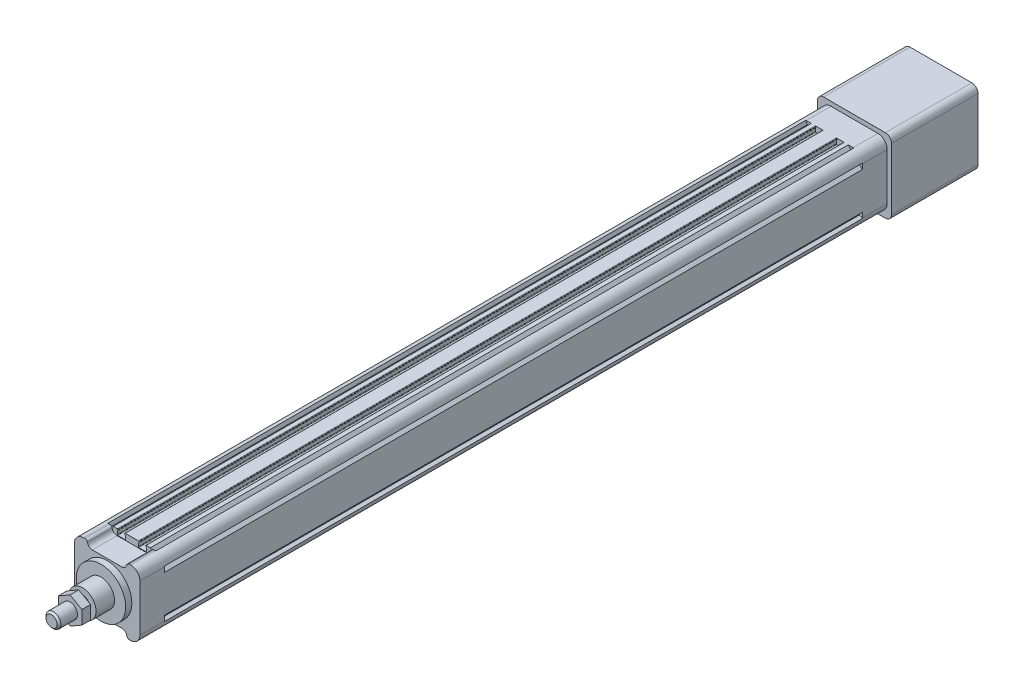
from build123d import *

# Parameters (mm, degrees)
SKETCH_1_R             = 2.1
EXTRUDE_1_DEPTH        = 565
EXTRUDE_2_DEPTH        = 20
SKETCH_7_R             = 20
EXTRUDE_3_DEPTH        = 5
SKETCH_9_R             = 11
EXTRUDE_4_DEPTH        = 15
SKETCH_10_R            = 6
EXTRUDE_5_DEPTH        = 25
EXTRUDE_START          = 20
EXTRUDE_6_DEPTH        = 20
EXTRUDE_7_DEPTH        = 70
SKETCH_14_R            = 19
CUT_EXTRUDE_2_DEPTH    = 70
HOLE_WIZARD_M6_1_D     = 5
HOLE_WIZARD_M6_1_DEPTH = 15
HOLE_WIZARD_M6_1_TIP   = 1.502151548
CHAMFER_1_SIZE         = 1.5
EXTRUDE_START_2        = 3
EXTRUDE_8_DEPTH        = 7


with BuildPart() as part:
    # 草图1 → 凸台-拉伸1 (new body)
    with BuildSketch(Plane.XY):
        with BuildLine():
            Line((-18.2, 24), (-19.443439638, 26.486879276))
            ThreePointArc((-19.443439638, 26.486879276), (-24.303300859, 24.303300859), (-26.486879276, 19.443439638))
            Line((-26.486879276, 19.443439638), (-24, 18.2))
            Line((-24, 18.2), (-24, 17.1))
            Line((-24, 17.1), (-26.5, 15))
            Line((-26.5, 15), (-26.5, -15))
            Line((-26.5, -15), (-24, -17.1))
            Line((-24, -17.1), (-24, -18.2))
            Line((-24, -18.2), (-26.486879276, -19.443439638))
            ThreePointArc((-26.486879276, -19.443439638), (-24.303300859, -24.303300859), (-19.443439638, -26.486879276))
            Line((-19.443439638, -26.486879276), (-18.2, -24))
            Line((-18.2, -24), (-17.1, -24))
            Line((-17.1, -24), (-15, -26.5))
            Line((-15, -26.5), (-11.65, -26.5))
            ThreePointArc((-11.65, -26.5), (-11.367157288, -26.382842712), (-11.25, -26.1))
            Line((-11.25, -26.1), (-11.25, -25.6))
            ThreePointArc((-11.25, -25.6), (-11.367157288, -25.317157288), (-11.65, -25.2))
            Line((-11.65, -25.2), (-11.75, -25.2))
            Line((-11.75, -25.2), (-11.75, -22.4))
            ThreePointArc((-11.75, -22.4), (-11.632842712, -22.117157288), (-11.35, -22))
            Line((-11.35, -22), (-5.65, -22))
            ThreePointArc((-5.65, -22), (-5.367157288, -22.117157288), (-5.25, -22.4))
            Line((-5.25, -22.4), (-5.25, -25.2))
            Line((-5.25, -25.2), (-5.35, -25.2))
            ThreePointArc((-5.35, -25.2), (-5.632842712, -25.317157288), (-5.75, -25.6))
            Line((-5.75, -25.6), (-5.75, -26.1))
            ThreePointArc((-5.75, -26.1), (-5.632842712, -26.382842712), (-5.35, -26.5))
            Line((-5.35, -26.5), (5.35, -26.5))
            ThreePointArc((5.35, -26.5), (5.632842712, -26.382842712), (5.75, -26.1))
            Line((5.75, -26.1), (5.75, -25.6))
            ThreePointArc((5.75, -25.6), (5.632842712, -25.317157288), (5.35, -25.2))
            Line((5.35, -25.2), (5.25, -25.2))
            Line((5.25, -25.2), (5.25, -22.4))
            ThreePointArc((5.25, -22.4), (5.367157288, -22.117157288), (5.65, -22))
            Line((5.65, -22), (11.35, -22))
            ThreePointArc((11.35, -22), (11.632842712, -22.117157288), (11.75, -22.4))
            Line((11.75, -22.4), (11.75, -25.2))
            Line((11.75, -25.2), (11.65, -25.2))
            ThreePointArc((11.65, -25.2), (11.367157288, -25.317157288), (11.25, -25.6))
            Line((11.25, -25.6), (11.25, -26.1))
            ThreePointArc((11.25, -26.1), (11.367157288, -26.382842712), (11.65, -26.5))
            Line((11.65, -26.5), (15, -26.5))
            Line((15, -26.5), (17.1, -24))
            Line((17.1, -24), (18.2, -24))
            Line((18.2, -24), (19.443439638, -26.486879276))
            ThreePointArc((19.443439638, -26.486879276), (24.303300859, -24.303300859), (26.486879276, -19.443439638))
            Line((26.486879276, -19.443439638), (24, -18.2))
            Line((24, -18.2), (24, -17.1))
            Line((24, -17.1), (26.5, -15))
            Line((26.5, -15), (26.5, 15))
            Line((26.5, 15), (24, 17.1))
            Line((24, 17.1), (24, 18.2))
            Line((24, 18.2), (26.486879276, 19.443439638))
            ThreePointArc((26.486879276, 19.443439638), (24.303300859, 24.303300859), (19.443439638, 26.486879276))
            Line((19.443439638, 26.486879276), (18.2, 24))
            Line((18.2, 24), (17.1, 24))
            Line((17.1, 24), (15, 26.5))
            Line((15, 26.5), (11.65, 26.5))
            ThreePointArc((11.65, 26.5), (11.367157288, 26.382842712), (11.25, 26.1))
            Line((11.25, 26.1), (11.25, 25.6))
            ThreePointArc((11.25, 25.6), (11.367157288, 25.317157288), (11.65, 25.2))
            Line((11.65, 25.2), (11.75, 25.2))
            Line((11.75, 25.2), (11.75, 22.4))
            ThreePointArc((11.75, 22.4), (11.632842712, 22.117157288), (11.35, 22))
            Line((11.35, 22), (5.65, 22))
            ThreePointArc((5.65, 22), (5.367157288, 22.117157288), (5.25, 22.4))
            Line((5.25, 22.4), (5.25, 25.2))
            Line((5.25, 25.2), (5.35, 25.2))
            ThreePointArc((5.35, 25.2), (5.632842712, 25.317157288), (5.75, 25.6))
            Line((5.75, 25.6), (5.75, 26.1))
            ThreePointArc((5.75, 26.1), (5.632842712, 26.382842712), (5.35, 26.5))
            Line((5.35, 26.5), (-5.35, 26.5))
            ThreePointArc((-5.35, 26.5), (-5.632842712, 26.382842712), (-5.75, 26.1))
            Line((-5.75, 26.1), (-5.75, 25.6))
            ThreePointArc((-5.75, 25.6), (-5.632842712, 25.317157288), (-5.35, 25.2))
            Line((-5.35, 25.2), (-5.25, 25.2))
            Line((-5.25, 25.2), (-5.25, 22.4))
            ThreePointArc((-5.25, 22.4), (-5.367157288, 22.117157288), (-5.65, 22))
            Line((-5.65, 22), (-11.35, 22))
            ThreePointArc((-11.35, 22), (-11.632842712, 22.117157288), (-11.75, 22.4))
            Line((-11.75, 22.4), (-11.75, 25.2))
            Line((-11.75, 25.2), (-11.65, 25.2))
            ThreePointArc((-11.65, 25.2), (-11.367157288, 25.317157288), (-11.25, 25.6))
            Line((-11.25, 25.6), (-11.25, 26.1))
            ThreePointArc((-11.25, 26.1), (-11.367157288, 26.382842712), (-11.65, 26.5))
            Line((-11.65, 26.5), (-15, 26.5))
            Line((-15, 26.5), (-17.1, 24))
            Line((-17.1, 24), (-18.2, 24))
        make_face()
        with Locations((19, 19)):
            Circle(SKETCH_1_R, mode=Mode.SUBTRACT)
        with Locations((19, -19)):
            Circle(SKETCH_1_R, mode=Mode.SUBTRACT)
        with Locations((-19, -19)):
            Circle(SKETCH_1_R, mode=Mode.SUBTRACT)
        with Locations((-19, 19)):
            Circle(SKETCH_1_R, mode=Mode.SUBTRACT)
        with BuildLine():
            Line((19.773719933, 3), (23.3, 3))
            Line((23.3, 3), (23.3, -3))
            Line((23.3, -3), (19.773719933, -3))
            ThreePointArc((19.773719933, -3), (0, -20), (-19.773719933, -3))
            Line((-19.773719933, -3), (-23.3, -3))
            Line((-23.3, -3), (-23.3, 3))
            Line((-23.3, 3), (-19.773719933, 3))
            ThreePointArc((-19.773719933, 3), (0, 20), (19.773719933, 3))
        make_face(mode=Mode.SUBTRACT)
    extrude(amount=EXTRUDE_1_DEPTH)

    # 草图6 → 凸台-拉伸2 (add)
    with BuildSketch(Plane.XY.offset(565)):
        with BuildLine():
            Line((-26.5, -19), (-26.5, 19))
            ThreePointArc((-26.5, 19), (-24.303300859, 24.303300859), (-19, 26.5))
            Line((-19, 26.5), (-17.916079783, 26.5))
            ThreePointArc((-17.916079783, 26.5), (-16.625085334, 26.027525232), (-15.944053189, 24.833333333))
            ThreePointArc((-15.944053189, 24.833333333), (-14.581988897, 22.444949537), (-12, 21.5))
            Line((-12, 21.5), (12, 21.5))
            ThreePointArc((12, 21.5), (14.581988897, 22.444949537), (15.944053189, 24.833333333))
            ThreePointArc((15.944053189, 24.833333333), (16.625085334, 26.027525232), (17.916079783, 26.5))
            Line((17.916079783, 26.5), (19, 26.5))
            ThreePointArc((19, 26.5), (24.303300859, 24.303300859), (26.5, 19))
            Line((26.5, 19), (26.5, -19))
            ThreePointArc((26.5, -19), (24.303300859, -24.303300859), (19, -26.5))
            Line((19, -26.5), (17.916079783, -26.5))
            ThreePointArc((17.916079783, -26.5), (16.625085334, -26.027525232), (15.944053189, -24.833333333))
            ThreePointArc((15.944053189, -24.833333333), (14.581988897, -22.444949537), (12, -21.5))
            Line((12, -21.5), (-12, -21.5))
            ThreePointArc((-12, -21.5), (-14.581988897, -22.444949537), (-15.944053189, -24.833333333))
            ThreePointArc((-15.944053189, -24.833333333), (-16.625085334, -26.027525232), (-17.916079783, -26.5))
            Line((-17.916079783, -26.5), (-19, -26.5))
            ThreePointArc((-19, -26.5), (-24.303300859, -24.303300859), (-26.5, -19))
        make_face()
    extrude(amount=EXTRUDE_2_DEPTH)

    # 草图7 → 凸台-拉伸3 (add)
    with BuildSketch(Plane.XY.offset(585)):
        Circle(SKETCH_7_R)
    extrude(amount=EXTRUDE_3_DEPTH)

    # 草图9 → 凸台-拉伸4 (add)
    with BuildSketch(Plane.XY.offset(590)):
        Circle(SKETCH_9_R)
    extrude(amount=EXTRUDE_4_DEPTH)

    # 草图10 → 凸台-拉伸5 (add)
    with BuildSketch(Plane.XY.offset(605)):
        Circle(SKETCH_10_R)
    extrude(amount=EXTRUDE_5_DEPTH)

    # 草图11 → 凸台-拉伸6 (add)
    with BuildSketch(Plane(origin=(0, 0, 0), x_dir=(-1, 0, 0), z_dir=(0, 0, -1)).offset(EXTRUDE_START)):
        with BuildLine():
            Line((-19, -26.5), (19, -26.5))
            ThreePointArc((19, -26.5), (24.303300859, -24.303300859), (26.5, -19))
            Line((26.5, -19), (26.5, 19))
            ThreePointArc((26.5, 19), (24.303300859, 24.303300859), (19, 26.5))
            Line((19, 26.5), (-19, 26.5))
            ThreePointArc((-19, 26.5), (-24.303300859, 24.303300859), (-26.5, 19))
            Line((-26.5, 19), (-26.5, -19))
            ThreePointArc((-26.5, -19), (-24.303300859, -24.303300859), (-19, -26.5))
        make_face()
    extrude(amount=-EXTRUDE_6_DEPTH)

    # 草图12 → 凸台-拉伸7 (add)
    with BuildSketch(Plane(origin=(0, 0, -20), x_dir=(-1, 0, 0), z_dir=(0, 0, -1))):
        with BuildLine():
            Line((-25, -30), (25, -30))
            ThreePointArc((25, -30), (28.535533906, -28.535533906), (30, -25))
            Line((30, -25), (30, 25))
            ThreePointArc((30, 25), (28.535533906, 28.535533906), (25, 30))
            Line((25, 30), (-25, 30))
            ThreePointArc((-25, 30), (-28.535533906, 28.535533906), (-30, 25))
            Line((-30, 25), (-30, -25))
            ThreePointArc((-30, -25), (-28.535533906, -28.535533906), (-25, -30))
        make_face()
    extrude(amount=EXTRUDE_7_DEPTH)

    # 草图14 → 切除-拉伸2 (cut)
    with BuildSketch(Plane(origin=(0, 0, -90), x_dir=(-1, 0, 0), z_dir=(0, 0, -1))):
        Circle(SKETCH_14_R)
    extrude(amount=-CUT_EXTRUDE_2_DEPTH, mode=Mode.SUBTRACT)

    # M6 螺纹孔1
    with Locations(Plane.ZY.offset(26.5)):
        with Locations((575, 11), (575, -11), (-10, 11), (-10, -11)):
            Hole(HOLE_WIZARD_M6_1_D / 2, depth=HOLE_WIZARD_M6_1_DEPTH)
            with Locations((0, 0, -(HOLE_WIZARD_M6_1_DEPTH + HOLE_WIZARD_M6_1_TIP / 2))):  # 118° drill point
                Cone(0, HOLE_WIZARD_M6_1_D / 2, HOLE_WIZARD_M6_1_TIP, mode=Mode.SUBTRACT)

    # 倒角1
    chamfer_1_edges = [part.edges().sort_by_distance(p)[0] for p in [
        (-6, 0, 630),
    ]]
    chamfer(chamfer_1_edges, length=CHAMFER_1_SIZE)

    # 草图17 → 凸台-拉伸8 (add)
    with BuildSketch(Plane.XY.offset(605).offset(EXTRUDE_START_2)):
        Polygon((0, 10.969655115), (-9.5, 5.484827557), (-9.5, -5.484827557), (0, -10.969655115), (9.5, -5.484827557), (9.5, 5.484827557), align=None)
    extrude(amount=EXTRUDE_8_DEPTH)


solid = part.part
